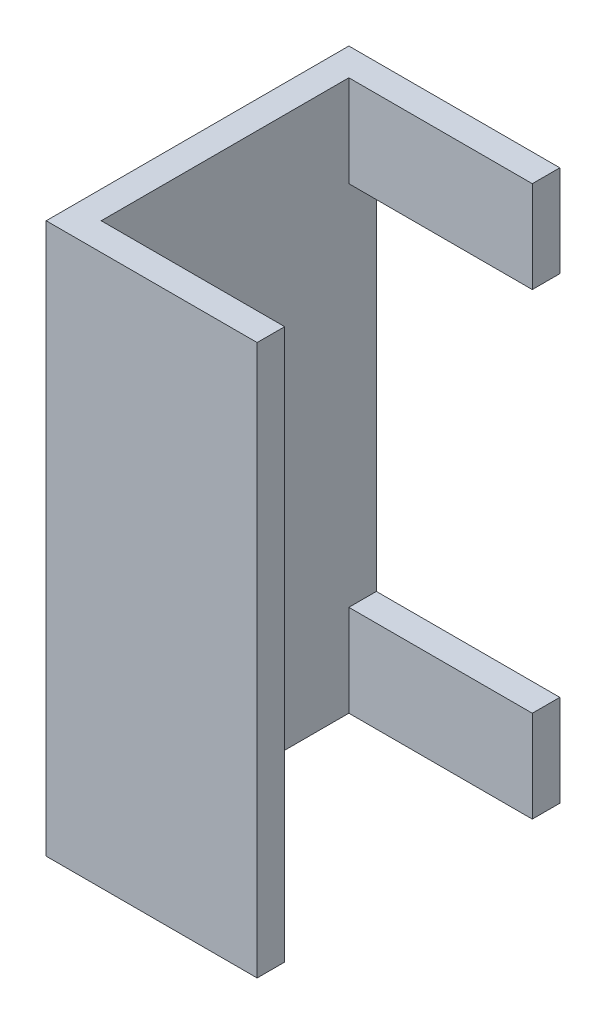
from build123d import *

# Parameters (mm, degrees)
BOSS_EXTRU_1_DEPTH      = 36
ESQUISSE2_W             = 20
ESQUISSE2_H             = 10
ENL_V_MAT_EXTRU_1_DEPTH = 33
ESQUISSE3_W             = 20
ESQUISSE3_H             = 10
ENL_V_MAT_EXTRU_2_DEPTH = 33
ESQUISSE5_W             = 6
ESQUISSE5_H             = 60
BOSS_EXTRU_3_DEPTH      = 20
ESQUISSE6_W             = 3
ESQUISSE6_H             = 60
ENL_V_MAT_EXTRU_3_DEPTH = 50


with BuildPart() as part:
    # Esquisse1 → Boss.-Extru.1 (new body)
    with BuildSketch(Plane.XY):
        Polygon((-21.058577834, 39.100001216), (-44.058577834, 39.100001216), (-44.058577834, -20.899998784), (-21.058577834, -20.899998784), (-21.058577834, -10.899998784), (-41.058577834, -10.899998784), (-41.058577834, 29.100001216), (-21.058577834, 29.100001216), align=None)
    extrude(amount=BOSS_EXTRU_1_DEPTH)

    # Esquisse2 → Enlèv. mat.-Extru.1 (cut)
    with BuildSketch(Plane.XY.offset(36)):
        with Locations((-31.058577834, 34.100001216)):
            Rectangle(ESQUISSE2_W, ESQUISSE2_H)
    extrude(amount=-ENL_V_MAT_EXTRU_1_DEPTH, mode=Mode.SUBTRACT)

    # Esquisse3 → Enlèv. mat.-Extru.2 (cut)
    with BuildSketch(Plane.XY.offset(36)):
        with Locations((-31.058577834, -15.899998784)):
            Rectangle(ESQUISSE3_W, ESQUISSE3_H)
    extrude(amount=-ENL_V_MAT_EXTRU_2_DEPTH, mode=Mode.SUBTRACT)

    # Esquisse5 → Boss.-Extru.3 (add)
    with BuildSketch(Plane(origin=(-41.058577834, 0, 0), x_dir=(0, 0, -1), z_dir=(1, 0, 0))):
        with Locations((-33, 9.100001216)):
            Rectangle(ESQUISSE5_W, ESQUISSE5_H)
    extrude(amount=BOSS_EXTRU_3_DEPTH)

    # Esquisse6 → Enlèv. mat.-Extru.3 (cut)
    with BuildSketch(Plane(origin=(-21.058577834, 0, 0), x_dir=(0, 0, -1), z_dir=(1, 0, 0))):
        with Locations((-34.5, 9.100001216)):
            Rectangle(ESQUISSE6_W, ESQUISSE6_H)
    extrude(amount=-ENL_V_MAT_EXTRU_3_DEPTH, mode=Mode.SUBTRACT)


solid = part.part
